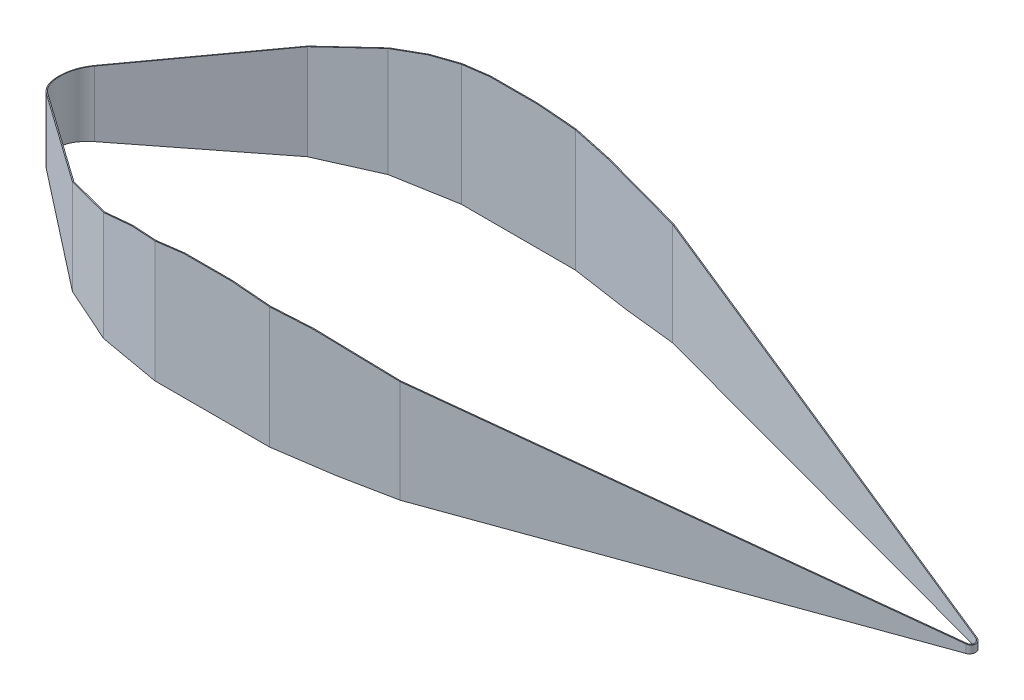
from build123d import *

# Parameters (mm, degrees)
TOPVIEW_EXTRUDE_DEPTH      = 800
SHELL1_T                   = -5
SIDEPROFILE_CUT_DEPTH      = 5006.734380578
SIDEPROFILE_CUT_DEPTH_BACK = 5006.734380578
SKETCH2_OUTSIDE_W          = 5798.358
SKETCH2_OUTSIDE_H          = 1822.06


with BuildPart() as part:
    # Sketch1 → TopView_Extrude (new body)
    with BuildSketch(Plane(origin=(0, 0, 0), x_dir=(1, 0, 0), z_dir=(0, 1, 0))):
        with BuildLine():
            Line((161.409759475, 126.088702216), (784.13, 612.54))
            Line((784.13, 612.54), (1076.464, 742.696))
            Line((1076.464, 742.696), (1401.451, 800))
            Line((1401.451, 800), (1997.019, 800))
            Line((1997.019, 800), (2590.582, 712.35))
            Line((2590.582, 712.35), (4854.876103105, 28.719585912))
            ThreePointArc((4854.876103105, 28.719585912), (4876.205152462, 0), (4854.876103105, -28.719585912))
            Line((4854.876103105, -28.719585912), (2590.582, -712.35))
            Line((2590.582, -712.35), (1997.019, -800))
            Line((1997.019, -800), (1401.451, -800))
            Line((1401.451, -800), (1076.464, -742.696))
            Line((1076.464, -742.696), (784.13, -612.54))
            Line((784.13, -612.54), (161.409759475, -126.088702216))
            ThreePointArc((161.409759475, -126.088702216), (99.906658784, 0), (161.409759475, 126.088702216))
        make_face()
    extrude(amount=TOPVIEW_EXTRUDE_DEPTH)

    # Shell1
    shell1_openings = [part.faces().sort_by_distance(p)[0] for p in [
        (2160.780992179, 0, 0),
        (2160.780992179, 800, 0),
    ]]
    offset(amount=SHELL1_T, openings=shell1_openings, kind=Kind.INTERSECTION)

    # Sketch2 outside → SideProfile_Cut (cut, two sides: drawn at the far end of the back side and taken through both)
    with BuildSketch(Plane.XY.offset(-SIDEPROFILE_CUT_DEPTH_BACK)):
        with Locations((2488.056, 400)):
            Rectangle(SKETCH2_OUTSIDE_W, SKETCH2_OUTSIDE_H)
        with BuildLine():
            Line((0, 300), (0, 332.854109989))
            ThreePointArc((0, 332.854109989), (31.780435884, 425.180350356), (113.655128803, 478.384348558))
            Line((113.655128803, 478.384348558), (1255.921, 763.655))
            Line((1255.921, 763.655), (1551.451, 800))
            Line((1551.451, 800), (1800, 800))
            Line((1800, 800), (2197.056, 765.81))
            Line((2197.056, 765.81), (4950, 288.165))
            Line((4950, 288.165), (4950, 265.638))
            Line((4950, 265.638), (2301.451, 150))
            Line((2301.451, 150), (150, 150))
            ThreePointArc((150, 150), (43.933982822, 193.933982822), (0, 300))
        make_face(mode=Mode.SUBTRACT)
    extrude(amount=SIDEPROFILE_CUT_DEPTH + SIDEPROFILE_CUT_DEPTH_BACK, mode=Mode.SUBTRACT)


solid = part.part
